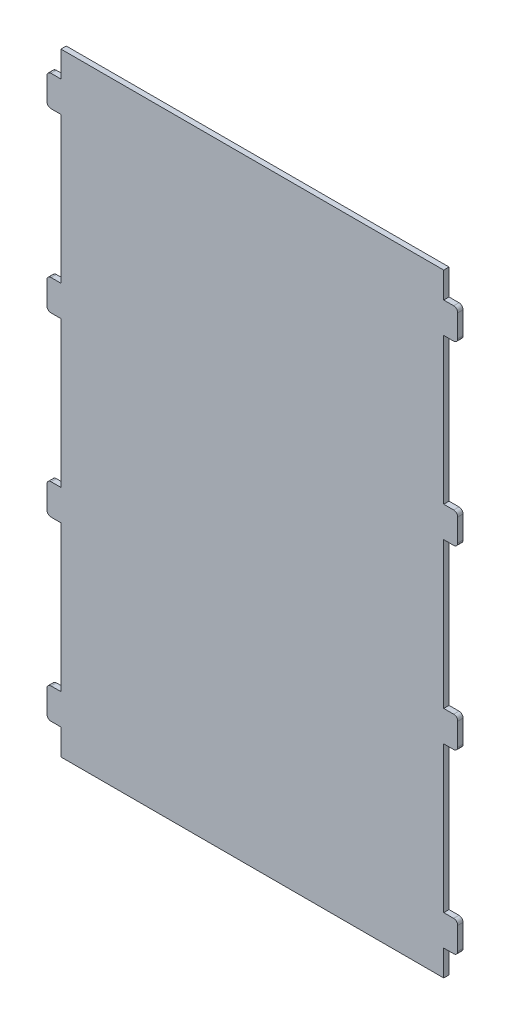
from build123d import *

# Parameters (mm, degrees)
BOSS_EXTRUDE1_DEPTH = 2.6


with BuildPart() as part:
    # Model → Boss-Extrude1 (new body)
    with BuildSketch(Plane.XY):
        with BuildLine():
            Line((93.65, 50.766666667), (93.65, 122.3))
            Line((93.65, 122.3), (98.51, 122.3))
            ThreePointArc((98.51, 122.3), (99.924213562, 122.885786438), (100.51, 124.3))
            Line((100.51, 124.3), (100.51, 135.3))
            ThreePointArc((100.51, 135.3), (99.924213562, 136.714213562), (98.51, 137.3))
            Line((98.51, 137.3), (93.65, 137.3))
            Line((93.65, 137.3), (93.65, 150))
            Line((93.65, 150), (-93.65, 150))
            Line((-93.65, 150), (-93.65, 137.3))
            Line((-93.65, 137.3), (-98.51, 137.3))
            ThreePointArc((-98.51, 137.3), (-99.924213562, 136.714213562), (-100.51, 135.3))
            Line((-100.51, 135.3), (-100.51, 124.3))
            ThreePointArc((-100.51, 124.3), (-99.924213562, 122.885786438), (-98.51, 122.3))
            Line((-98.51, 122.3), (-93.65, 122.3))
            Line((-93.65, 122.3), (-93.65, 50.766666667))
            Line((-93.65, 50.766666667), (-98.51, 50.766666667))
            ThreePointArc((-98.51, 50.766666667), (-99.924213562, 50.180880229), (-100.51, 48.766666667))
            Line((-100.51, 48.766666667), (-100.51, 37.766666667))
            ThreePointArc((-100.51, 37.766666667), (-99.924213562, 36.352453104), (-98.51, 35.766666667))
            Line((-98.51, 35.766666667), (-93.65, 35.766666667))
            Line((-93.65, 35.766666667), (-93.65, -35.766666667))
            Line((-93.65, -35.766666667), (-98.51, -35.766666667))
            ThreePointArc((-98.51, -35.766666667), (-99.924213562, -36.352453104), (-100.51, -37.766666667))
            Line((-100.51, -37.766666667), (-100.51, -48.766666667))
            ThreePointArc((-100.51, -48.766666667), (-99.924213562, -50.180880229), (-98.51, -50.766666667))
            Line((-98.51, -50.766666667), (-93.65, -50.766666667))
            Line((-93.65, -50.766666667), (-93.65, -122.3))
            Line((-93.65, -122.3), (-98.51, -122.3))
            ThreePointArc((-98.51, -122.3), (-99.924213562, -122.885786438), (-100.51, -124.3))
            Line((-100.51, -124.3), (-100.51, -135.3))
            ThreePointArc((-100.51, -135.3), (-99.924213562, -136.714213562), (-98.51, -137.3))
            Line((-98.51, -137.3), (-93.65, -137.3))
            Line((-93.65, -137.3), (-93.65, -150))
            Line((-93.65, -150), (93.65, -150))
            Line((93.65, -150), (93.65, -137.3))
            Line((93.65, -137.3), (98.51, -137.3))
            ThreePointArc((98.51, -137.3), (99.924213562, -136.714213562), (100.51, -135.3))
            Line((100.51, -135.3), (100.51, -124.3))
            ThreePointArc((100.51, -124.3), (99.924213562, -122.885786438), (98.51, -122.3))
            Line((98.51, -122.3), (93.65, -122.3))
            Line((93.65, -122.3), (93.65, -50.766666667))
            Line((93.65, -50.766666667), (98.51, -50.766666667))
            ThreePointArc((98.51, -50.766666667), (99.924213562, -50.180880229), (100.51, -48.766666667))
            Line((100.51, -48.766666667), (100.51, -37.766666667))
            ThreePointArc((100.51, -37.766666667), (99.924213562, -36.352453104), (98.51, -35.766666667))
            Line((98.51, -35.766666667), (93.65, -35.766666667))
            Line((93.65, -35.766666667), (93.65, 35.766666667))
            Line((93.65, 35.766666667), (98.51, 35.766666667))
            ThreePointArc((98.51, 35.766666667), (99.924213562, 36.352453104), (100.51, 37.766666667))
            Line((100.51, 37.766666667), (100.51, 48.766666667))
            ThreePointArc((100.51, 48.766666667), (99.924213562, 50.180880229), (98.51, 50.766666667))
            Line((98.51, 50.766666667), (93.65, 50.766666667))
        make_face()
    extrude(amount=BOSS_EXTRUDE1_DEPTH)


solid = part.part
